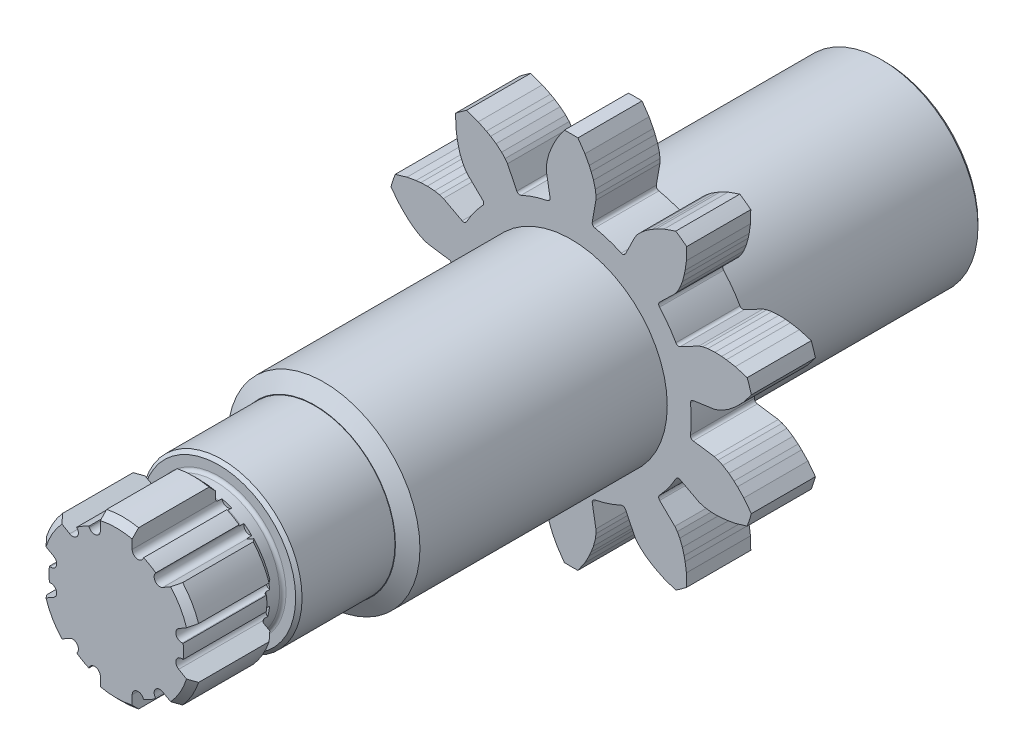
from build123d import *

# Parameters (mm, degrees)
ESQUISSE1_R                  = 29.25
BASE_EXTRUSION_DEPTH         = 10
ENL_V_MAT_EXTRU_1_DEPTH      = 43.557314295
R_P_TITION_CIRCULAIRE1_COUNT = 10
BOSS_EXTRU_1_DEPTH           = 40
BOSS_EXTRU_1_DEPTH_BACK      = 49
ESQUISSE3_R                  = 15
ESQUISSE4_R                  = 12.5
BOSS_EXTRU_2_DEPTH           = 31
ESQUISSE5_OUTSIDE_W          = 87.226
ESQUISSE5_OUTSIDE_H          = 89.474
ESQUISSE5_OUTSIDE_R          = 10
ENL_V_MAT_EXTRU_2_DEPTH      = 3
CHANFREIN1_SIZE              = 0.5
CHANFREIN2_SIZE              = 1
CHANFREIN3_SIZE              = 2.424871131
CHANFREIN3_SIZE2             = 1.4
CONG_2_R                     = 0.5
ENL_V_MAT_EXTRU_3_DEPTH      = 14
R_P_TITION_CIRCULAIRE2_COUNT = 6


with BuildPart() as part:
    # Esquisse1 → Base-Extrusion (new body)
    with BuildSketch(Plane.XY):
        Circle(ESQUISSE1_R)
    extrude(amount=BASE_EXTRUSION_DEPTH)

    # Esquisse2 → Enlèv. mat.-Extru.1 (cut, through all)
    with BuildSketch(Plane.XY.offset(10)):
        with BuildLine():
            Line((1.054857226, 29.230972892), (2.153979018, 27.637740977))
            Line((2.153979018, 27.637740977), (2.813735508, 26.385915302))
            Line((2.813735508, 26.385915302), (3.118975564, 25.704109438))
            Line((3.118975564, 25.704109438), (3.489848129, 24.737353775))
            Line((3.489848129, 24.737353775), (3.627156031, 24.194659923))
            Line((3.627156031, 24.194659923), (3.764463933, 23.65196607))
            Line((3.764463933, 23.65196607), (3.867987042, 22.85898519))
            Line((3.867987042, 22.85898519), (3.859597952, 22.219907814))
            Line((3.859597952, 22.219907814), (3.70756595, 21.344651606))
            Line((3.70756595, 21.344651606), (3.293284083, 18.959609172))
            ThreePointArc((3.293284083, 18.959609172), (3.373360073, 18.591543583), (3.687572402, 18.383805639))
            ThreePointArc((3.687572402, 18.383805639), (5.794068645, 17.832309681), (7.822421094, 17.040311858))
            ThreePointArc((7.822421094, 17.040311858), (8.198729509, 17.023686012), (8.47985587, 17.274389842))
            Line((8.47985587, 17.274389842), (9.546587568, 19.447438475))
            Line((9.546587568, 19.447438475), (9.938053786, 20.244897791))
            Line((9.938053786, 20.244897791), (10.306907126, 20.766853232))
            Line((10.306907126, 20.766853232), (10.856761548, 21.347538884))
            Line((10.856761548, 21.347538884), (11.286833417, 21.705879873))
            Line((11.286833417, 21.705879873), (11.716905285, 22.064220863))
            Line((11.716905285, 22.064220863), (12.585192214, 22.628349199))
            Line((12.585192214, 22.628349199), (13.232892039, 23.000526127))
            Line((13.232892039, 23.000526127), (14.502450922, 23.625479237))
            Line((14.502450922, 23.625479237), (16.328137354, 24.268383353))
            ThreePointArc((16.328137354, 24.268383353), (9.038747085, 27.818403102), (1.054857226, 29.230972892))
        make_face()
    enl_v_mat_extru_1 = extrude(amount=-ENL_V_MAT_EXTRU_1_DEPTH, mode=Mode.SUBTRACT)

    # Répétition circulaire1: Enlèv. mat.-Extru.1 ×10 about axis
    r_p_tition_circulaire1_axis = Axis((0, 0, 0), (0, 0, 1))
    for i in range(1, R_P_TITION_CIRCULAIRE1_COUNT):
        add(enl_v_mat_extru_1.rotate(r_p_tition_circulaire1_axis, i * 360 / R_P_TITION_CIRCULAIRE1_COUNT), mode=Mode.SUBTRACT)

    # Esquisse3 → Boss.-Extru.1 (add, two sides: drawn at the far end of the back side and taken through both)
    with BuildSketch(Plane.XY.offset(10).offset(-BOSS_EXTRU_1_DEPTH_BACK)):
        Circle(ESQUISSE3_R)
    extrude(amount=BOSS_EXTRU_1_DEPTH + BOSS_EXTRU_1_DEPTH_BACK)

    # Esquisse4 → Boss.-Extru.2 (add)
    with BuildSketch(Plane.XY.offset(50)):
        Circle(ESQUISSE4_R)
    extrude(amount=BOSS_EXTRU_2_DEPTH)

    # Esquisse5 outside → Enlèv. mat.-Extru.2 (cut)
    with BuildSketch(Plane.XY.offset(68)):
        Rectangle(ESQUISSE5_OUTSIDE_W, ESQUISSE5_OUTSIDE_H)
        Circle(ESQUISSE5_OUTSIDE_R, mode=Mode.SUBTRACT)
    extrude(amount=-ENL_V_MAT_EXTRU_2_DEPTH, mode=Mode.SUBTRACT)

    # Chanfrein1
    chanfrein1_edges = [part.edges().sort_by_distance(p)[0] for p in [
        (-15, 0, -39),
        (-12.5, 0, 65),
    ]]
    chamfer(chanfrein1_edges, length=CHANFREIN1_SIZE)

    # Chanfrein2
    chanfrein2_edges = [part.edges().sort_by_distance(p)[0] for p in [
        (-12.5, 0, 81),
        (-12.5, 0, 68),
    ]]
    chamfer(chanfrein2_edges, length=CHANFREIN2_SIZE)

    # Chanfrein3
    chanfrein3_edges = [part.edges().sort_by_distance(p)[0] for p in [
        (-15, 0, 50),
    ]]
    chanfrein3_side = [part.faces().sort_by_distance(p)[0] for p in [
        (-14.575735931, 0, 50),
    ]]
    chamfer(chanfrein3_edges, length=CHANFREIN3_SIZE, length2=CHANFREIN3_SIZE2, reference=chanfrein3_side[0])

    # Congé2
    cong_2_edges = [part.edges().sort_by_distance(p)[0] for p in [
        (-10, 0, 65),
        (-10, 0, 68),
    ]]
    fillet(cong_2_edges, radius=CONG_2_R)

    # Esquisse6 → Enlèv. mat.-Extru.3 (cut)
    with BuildSketch(Plane.XY.offset(81)):
        with BuildLine():
            Line((2.482431829, 12.759879793), (2.482431829, 9.818583004))
            ThreePointArc((2.482431829, 9.818583004), (3.195311307, 8.938250163), (4.204622741, 9.452520025))
            Line((4.204622741, 9.452520025), (4.266767112, 9.592098568))
            ThreePointArc((4.266767112, 9.592098568), (5.24603236, 9.093138003), (6.167777509, 8.494549704))
            Line((6.167777509, 8.494549704), (6.07797113, 8.370941828))
            ThreePointArc((6.07797113, 8.370941828), (6.137256082, 7.239717555), (7.256086425, 7.062512238))
            Line((7.256086425, 7.062512238), (9.803324165, 8.533160632))
            ThreePointArc((9.803324165, 8.533160632), (6.49603236, 11.258201512), (2.482431829, 12.759879793))
        make_face()
    enl_v_mat_extru_3 = extrude(amount=-ENL_V_MAT_EXTRU_3_DEPTH, mode=Mode.SUBTRACT)

    # Répétition circulaire2: Enlèv. mat.-Extru.3 ×6 about axis
    r_p_tition_circulaire2_axis = Axis((0, 0, 0), (0, 0, 1))
    for i in range(1, R_P_TITION_CIRCULAIRE2_COUNT):
        add(enl_v_mat_extru_3.rotate(r_p_tition_circulaire2_axis, i * 360 / R_P_TITION_CIRCULAIRE2_COUNT), mode=Mode.SUBTRACT)


solid = part.part
